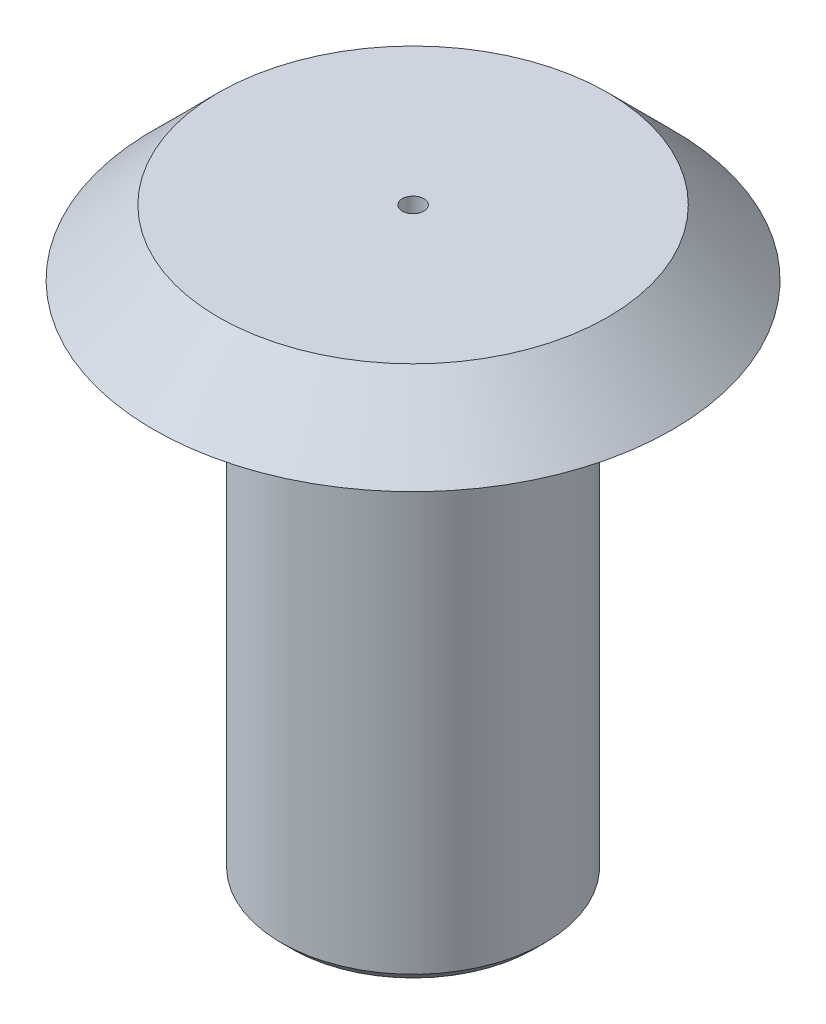
from build123d import *

# Parameters (mm, degrees)
CHAMFER2_SIZE = 0.5


with BuildPart() as part:
    # Sketch2 → Revolve1 (revolve)
    with BuildSketch(Plane.XY):
        with BuildLine():
            Line((12, 0), (9, 3))
            Line((9, 3), (1, 3))
            Line((1, 3), (0.5, 3))
            Line((0.5, 3), (0.5, 2.310660172))
            ThreePointArc((0.5, 2.310660172), (0.557090351, 2.023647598), (0.719669914, 1.780330086))
            Line((0.719669914, 1.780330086), (0.780330086, 1.719669914))
            ThreePointArc((0.780330086, 1.719669914), (0.942909649, 1.476352402), (1, 1.189339828))
            Line((1, 1.189339828), (1, -20.881966011))
            ThreePointArc((1, -20.881966011), (0.912870929, -21.290214302), (0.666666667, -21.627322004))
            ThreePointArc((0.666666667, -21.627322004), (0.5, -22), (0.666666667, -22.372677996))
            ThreePointArc((0.666666667, -22.372677996), (0.912870929, -22.709785698), (1, -23.118033989))
            Line((1, -23.118033989), (1, -24))
            Line((1, -24), (6.1, -24))
            Line((6.1, -24), (6.1, 1))
            Line((6.1, 1), (8, 1))
            Line((8, 1), (9, 0))
            Line((9, 0), (12, 0))
        make_face()
    revolve(axis=Axis((0, -747.512282571, 0), (0, 1, 0)))

    # Chamfer2
    chamfer2_edges = [part.edges().sort_by_distance(p)[0] for p in [
        (-1, -24, 0),
        (-6.1, -24, 0),
        (-6.1, 1, 0),
    ]]
    chamfer(chamfer2_edges, length=CHAMFER2_SIZE)


solid = part.part
